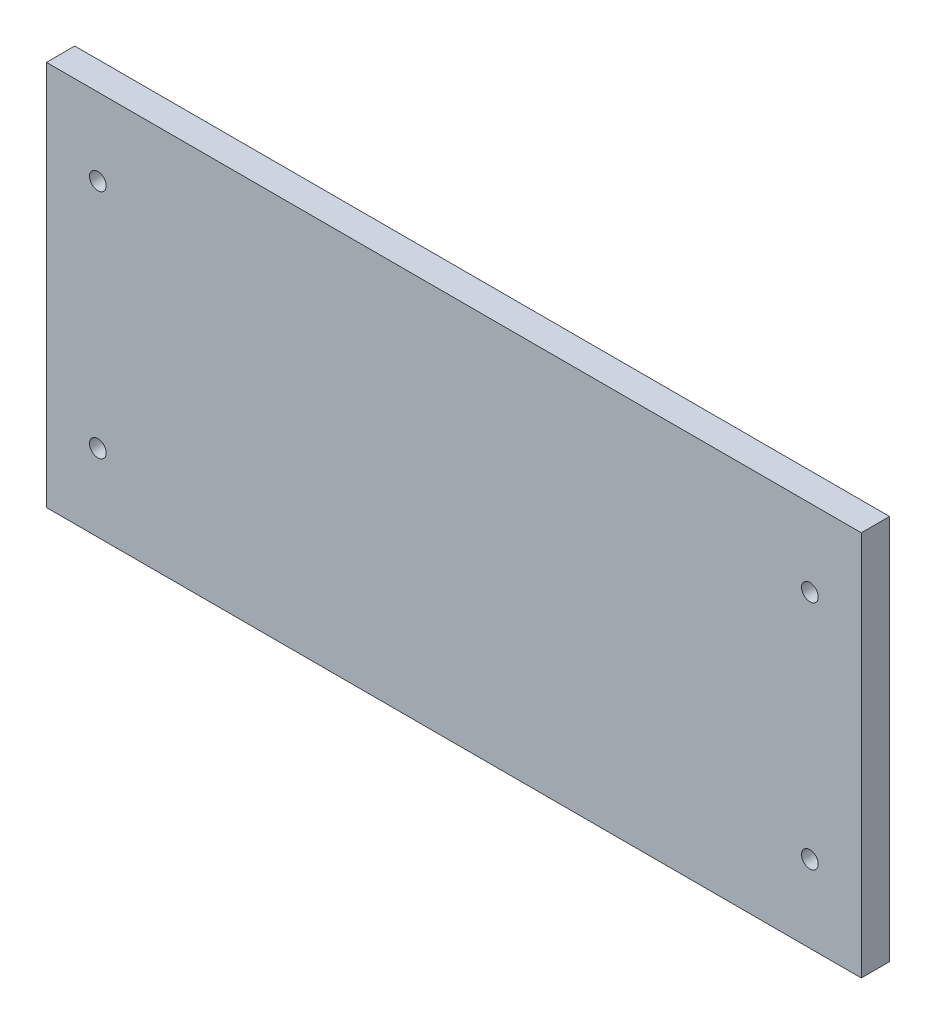
from build123d import *

# Parameters (mm, degrees)
SKETCH2_W           = 317
SKETCH2_H           = 150
SKETCH2_R           = 3.25
BOSS_EXTRUDE1_DEPTH = 11


with BuildPart() as part:
    # Sketch2 → Boss-Extrude1 (new body)
    with BuildSketch(Plane.XY):
        Rectangle(SKETCH2_W, SKETCH2_H)
        with Locations((-138.5, 45)):
            Circle(SKETCH2_R, mode=Mode.SUBTRACT)
        with Locations(Location((138.5, 45, 0), (0, 0, 180))):
            Circle(SKETCH2_R, mode=Mode.SUBTRACT)
        with Locations((138.5, -45)):
            Circle(SKETCH2_R, mode=Mode.SUBTRACT)
        with Locations(Location((-138.5, -45, 0), (0, 0, 180))):
            Circle(SKETCH2_R, mode=Mode.SUBTRACT)
    extrude(amount=BOSS_EXTRUDE1_DEPTH)


solid = part.part
